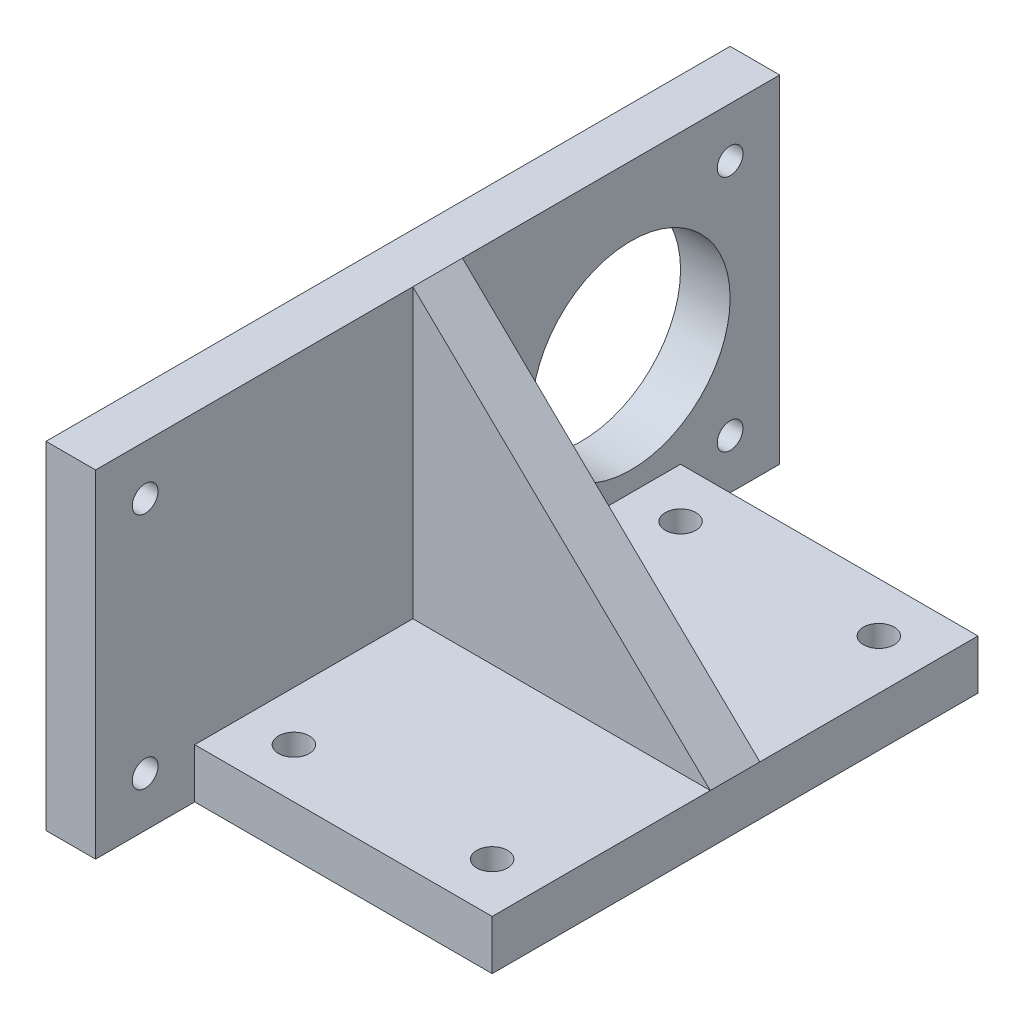
from build123d import *

# Parameters (mm, degrees)
SKETCH1_W           = 69
SKETCH1_H           = 34
SKETCH1_R           = 1.3
SKETCH1_R_2         = 10
BOSS_EXTRUDE1_DEPTH = 5
SKETCH2_W           = 49
SKETCH2_H           = 5
BOSS_EXTRUDE2_DEPTH = 30
BOSS_EXTRUDE3_DEPTH = 2.5
SKETCH4_R           = 1.55
CUT_EXTRUDE1_DEPTH  = 5


with BuildPart() as part:
    # Sketch1 → Boss-Extrude1 (new body)
    with BuildSketch(Plane(origin=(0, 0, 0), x_dir=(0, 0, -1), z_dir=(1, 0, 0))):
        Rectangle(SKETCH1_W, SKETCH1_H)
        with Locations((-29.5, 12)):
            Circle(SKETCH1_R, mode=Mode.SUBTRACT)
        with Locations((-29.5, -12)):
            Circle(SKETCH1_R, mode=Mode.SUBTRACT)
        with Locations((29.5, 12)):
            Circle(SKETCH1_R, mode=Mode.SUBTRACT)
        with Locations((29.5, -12)):
            Circle(SKETCH1_R, mode=Mode.SUBTRACT)
        with Locations((19.5, 0)):
            Circle(SKETCH1_R_2, mode=Mode.SUBTRACT)
    extrude(amount=BOSS_EXTRUDE1_DEPTH)

    # Sketch2 → Boss-Extrude2 (add)
    with BuildSketch(Plane(origin=(5, 0, 0), x_dir=(0, 0, -1), z_dir=(1, 0, 0))):
        with Locations((0, -14.5)):
            Rectangle(SKETCH2_W, SKETCH2_H)
    extrude(amount=BOSS_EXTRUDE2_DEPTH)

    # Sketch3 → Boss-Extrude3 (add, symmetric)
    with BuildSketch(Plane.XY):
        Polygon((5, -12), (35, -12), (5, 17), align=None)
    extrude(amount=BOSS_EXTRUDE3_DEPTH, both=True)

    # Sketch4 → Cut-Extrude1 (cut)
    with BuildSketch(Plane.XZ.offset(17)):
        with Locations(Location((30, 19.5, 0), (0, 0, 270))):
            Circle(SKETCH4_R)
        with Locations(Location((10, 19.5, 0), (0, 0, 270))):
            Circle(SKETCH4_R)
        with Locations(Location((10, -19.5, 0), (0, 0, 90))):
            Circle(SKETCH4_R)
        with Locations(Location((30, -19.5, 0), (0, 0, 90))):
            Circle(SKETCH4_R)
    extrude(amount=-CUT_EXTRUDE1_DEPTH, mode=Mode.SUBTRACT)


solid = part.part
